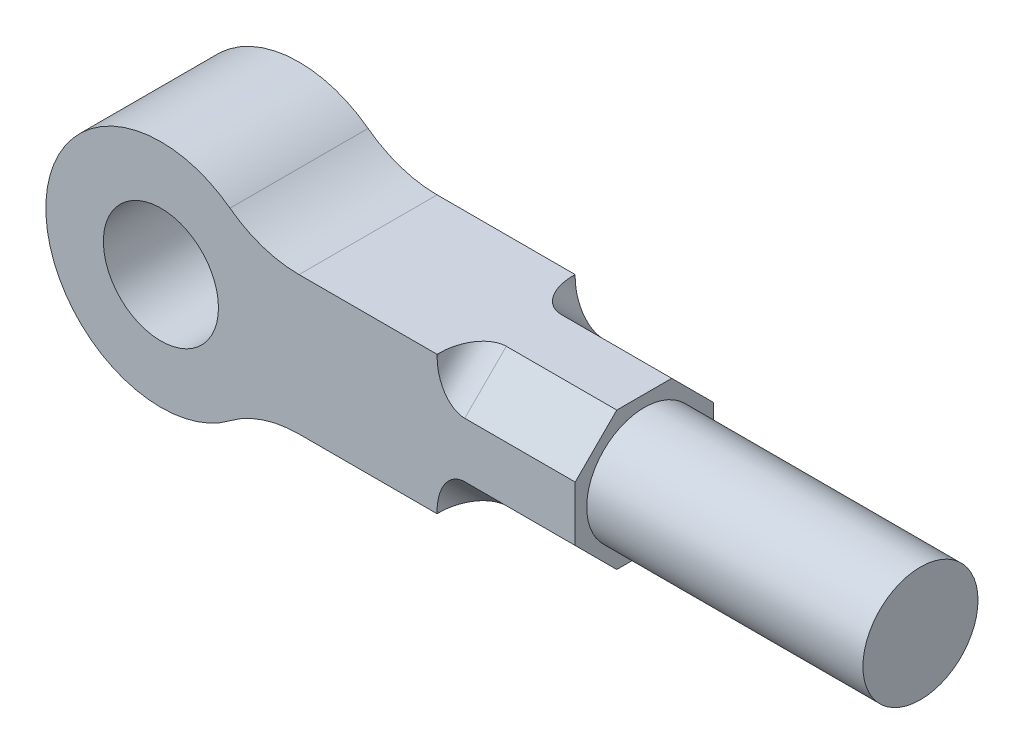
from build123d import *

# Parameters (mm, degrees)
SKETCH1_R           = 250
BOSS_EXTRUDE1_DEPTH = 600
FILLET1_R           = 500
FILLET2_R           = 500
CUT_EXTRUDE2_DEPTH  = 600
SKETCH2_4_R         = 250
BOSS_EXTRUDE2_DEPTH = 1200
FILLET3_R           = 120


with BuildPart() as part:
    # Sketch1 → Boss-Extrude1 (new body)
    with BuildSketch(Plane.XY):
        with BuildLine():
            Line((400, 300), (1800, 300))
            Line((1800, 300), (1800, -300))
            Line((1800, -300), (400, -300))
            ThreePointArc((400, -300), (-500, 0), (400, 300))
        make_face()
        Circle(SKETCH1_R, mode=Mode.SUBTRACT)
    extrude(amount=BOSS_EXTRUDE1_DEPTH)

    # Fillet1
    fillet1_edges = [part.edges().sort_by_distance(p)[0] for p in [
        (400, 300, 300),
    ]]
    fillet(fillet1_edges, radius=FILLET1_R)

    # Fillet2
    fillet2_edges = [part.edges().sort_by_distance(p)[0] for p in [
        (400, -300, 300),
    ]]
    fillet(fillet2_edges, radius=FILLET2_R)

    # Sketch2 → Cut-Extrude2 (cut)
    with BuildSketch(Plane(origin=(1800, 0, 0), x_dir=(0, 0, -1), z_dir=(1, 0, 0))):
        Polygon((0, 119.4), (0, 300), (-180.6, 300), align=None)
        Polygon((-600, 119.4), (-419.4, 300), (-600, 300), align=None)
        Polygon((0, -300), (0, -119.4), (-180.6, -300), align=None)
        Polygon((-419.4, -300), (-600, -119.4), (-600, -300), align=None)
    extrude(amount=-CUT_EXTRUDE2_DEPTH, mode=Mode.SUBTRACT)

    # Sketch2<4> → Boss-Extrude2 (add)
    with BuildSketch(Plane(origin=(1800, 0, 0), x_dir=(0, 0, -1), z_dir=(1, 0, 0))):
        with Locations((-300, 0)):
            Circle(SKETCH2_4_R)
    extrude(amount=BOSS_EXTRUDE2_DEPTH)

    # Fillet3
    fillet3_edges = [part.edges().sort_by_distance(p)[0] for p in [
        (1200, -209.7, 509.7),
        (1200, -209.7, 90.3),
        (1200, 209.7, 90.3),
        (1200, 209.7, 509.7),
    ]]
    fillet(fillet3_edges, radius=FILLET3_R)


solid = part.part
